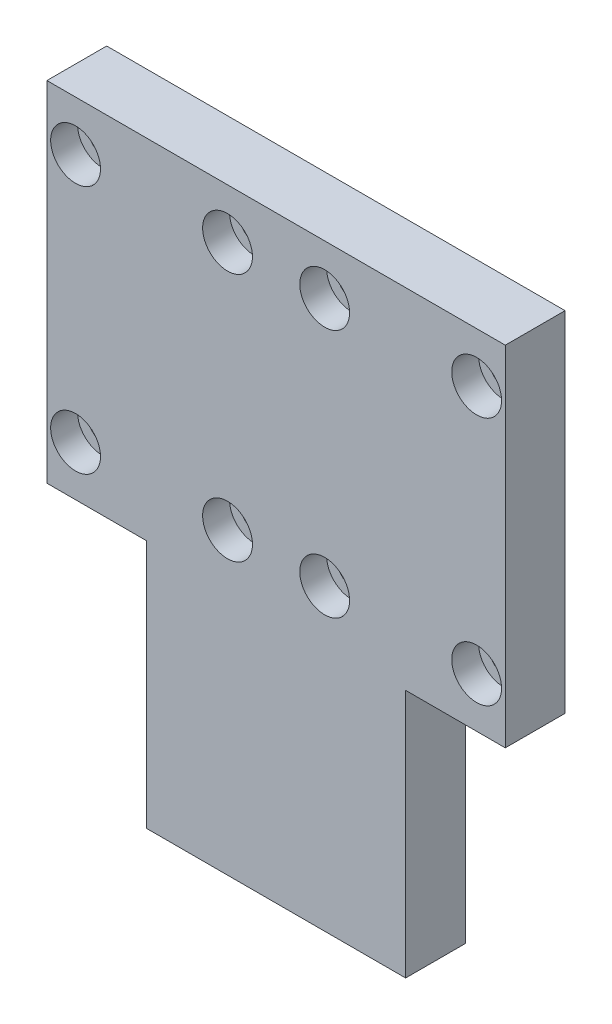
from build123d import *

# Parameters (mm, degrees)
SKETCH1_W                                           = 92
SKETCH1_H                                           = 120
BOSS_EXTRUDE1_DEPTH                                 = 12
CBORE_FOR_M5_HEX_SOCKET_HEAD_CAP_SCREW1_D           = 5.5
CBORE_FOR_M5_HEX_SOCKET_HEAD_CAP_SCREW1_CBORE_D     = 10
CBORE_FOR_M5_HEX_SOCKET_HEAD_CAP_SCREW1_CBORE_DEPTH = 5.4
CUT_EXTRUDE1_REACH                                  = 78.551
SKETCH4_W                                           = 20
SKETCH4_H                                           = 50


with BuildPart() as part:
    # Sketch1 → Boss-Extrude1 (new body)
    with BuildSketch(Plane.XY):
        Rectangle(SKETCH1_W, SKETCH1_H)
    extrude(amount=BOSS_EXTRUDE1_DEPTH)

    # CBORE for M5 Hex Socket Head Cap Screw1 (through all)
    with Locations(Plane.XY.offset(12)):
        with Locations((-40.25, 50), (-9.75, 50), (-9.75, 0), (-40.25, 0)):
            cbore_for_m5_hex_socket_head_cap_screw1 = CounterBoreHole(CBORE_FOR_M5_HEX_SOCKET_HEAD_CAP_SCREW1_D / 2, CBORE_FOR_M5_HEX_SOCKET_HEAD_CAP_SCREW1_CBORE_D / 2, CBORE_FOR_M5_HEX_SOCKET_HEAD_CAP_SCREW1_CBORE_DEPTH)

    # Mirror1: CBORE for M5 Hex Socket Head Cap Screw1 across plane
    add(cbore_for_m5_hex_socket_head_cap_screw1.mirror(Plane(origin=(0, 0, 0), x_dir=(0, 0, 1), z_dir=(1, 0, 0))), mode=Mode.SUBTRACT)

    # Sketch4 → Cut-Extrude1 (cut, up to next)
    with BuildSketch(Plane.XY.offset(12), mode=Mode.PRIVATE) as cut_extrude1_sk1:
        with Locations((-36, -35)):
            Rectangle(SKETCH4_W, SKETCH4_H)
    cut_extrude1_tool1 = extrude(cut_extrude1_sk1.sketch, amount=-CUT_EXTRUDE1_REACH, mode=Mode.PRIVATE) & part.part
    cut_extrude1 = cut_extrude1_tool1.solids().sort_by_distance((-36, -35, 12))[0]
    add(cut_extrude1, mode=Mode.SUBTRACT)

    # Mirror2: Cut-Extrude1 across plane
    add(cut_extrude1.mirror(Plane(origin=(0, 0, 0), x_dir=(0, 0, 1), z_dir=(1, 0, 0))), mode=Mode.SUBTRACT)


solid = part.part
